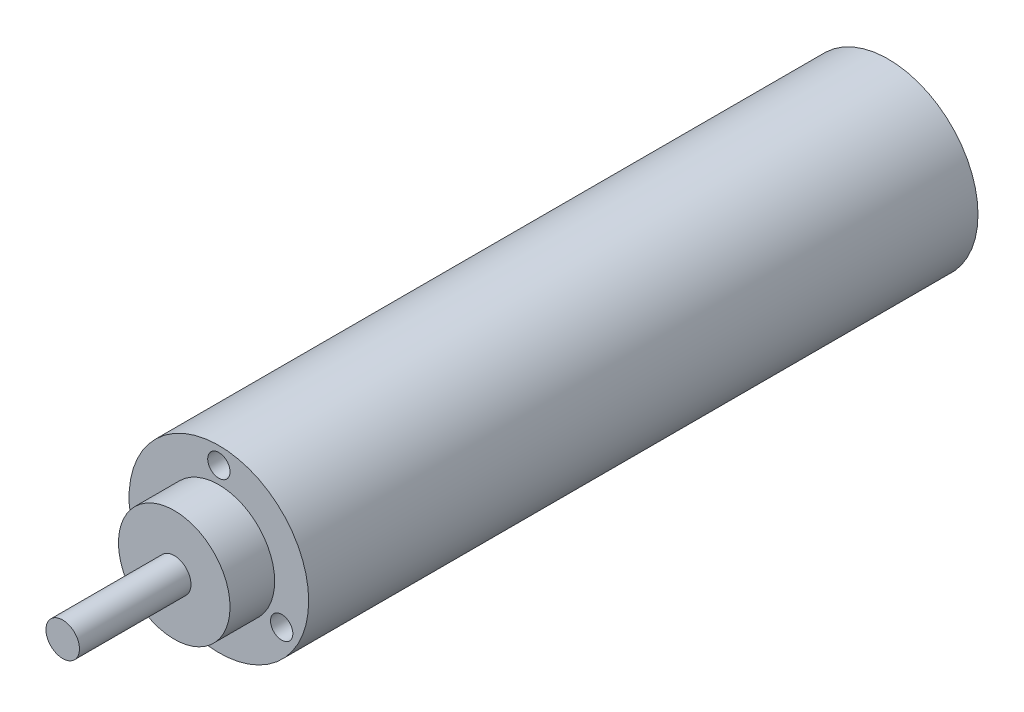
from build123d import *

# Parameters (mm, degrees)
SKETCH1_R           = 8.05
BOSS_EXTRUDE1_DEPTH = 60
SKETCH2_R           = 5
BOSS_EXTRUDE2_DEPTH = 4
SKETCH3_R           = 1
CUT_EXTRUDE1_DEPTH  = 5
SKETCH4_R           = 1.5
BOSS_EXTRUDE3_DEPTH = 10


with BuildPart() as part:
    # Sketch1 → Boss-Extrude1 (new body)
    with BuildSketch(Plane.XY):
        Circle(SKETCH1_R)
    extrude(amount=BOSS_EXTRUDE1_DEPTH)

    # Sketch2 → Boss-Extrude2 (add)
    with BuildSketch(Plane.XY.offset(60)):
        Circle(SKETCH2_R)
    extrude(amount=BOSS_EXTRUDE2_DEPTH)

    # Sketch3 → Cut-Extrude1 (cut)
    with BuildSketch(Plane.XY.offset(60)):
        with Locations((0, 6.5)):
            Circle(SKETCH3_R)
        with Locations((5.629165125, -3.25)):
            Circle(SKETCH3_R)
        with Locations((-5.629165125, -3.25)):
            Circle(SKETCH3_R)
    extrude(amount=-CUT_EXTRUDE1_DEPTH, mode=Mode.SUBTRACT)

    # Sketch4 → Boss-Extrude3 (add)
    with BuildSketch(Plane.XY.offset(64)):
        Circle(SKETCH4_R)
    extrude(amount=BOSS_EXTRUDE3_DEPTH)


solid = part.part
